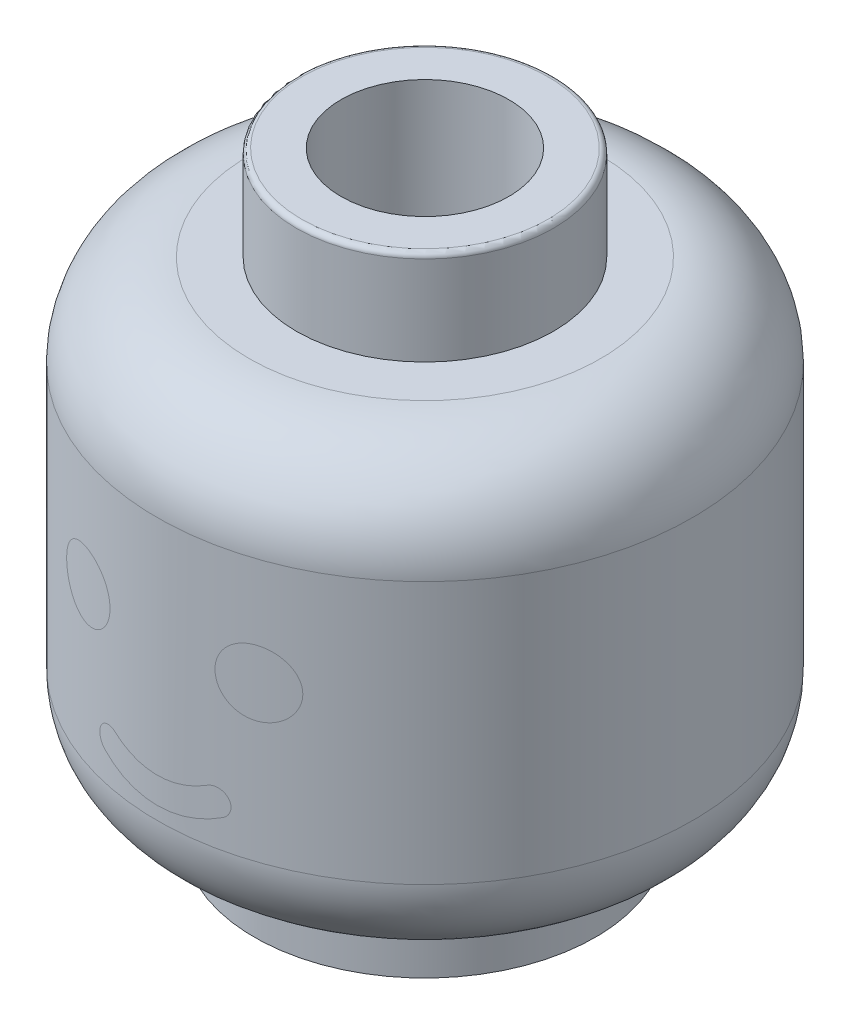
from build123d import *

# Parameters (mm, degrees)
SKETCH4_R          = 1.6
CUT_EXTRUDE1_DEPTH = 2
CUT_EXTRUDE2_REACH = 15.49
CIRPATTERN1_COUNT  = 3
FILLET1_R          = 0.1


with BuildPart() as part:
    # Sketch2 → Revolve1 (revolve)
    with BuildSketch(Plane(origin=(0, 0, 0), x_dir=(0, 0, -1), z_dir=(1, 0, 0))):
        with BuildLine():
            Line((2.45, 0), (3.25, 0))
            Line((3.25, 0), (3.25, 1.1))
            Line((3.25, 1.1), (3.35, 1.1))
            ThreePointArc((3.35, 1.1), (4.587436867, 1.612563133), (5.1, 2.85))
            Line((5.1, 2.85), (5.1, 7.85))
            ThreePointArc((5.1, 7.85), (4.587436867, 9.087436867), (3.35, 9.6))
            Line((3.35, 9.6), (2.45, 9.6))
            Line((2.45, 9.6), (2.45, 11.4))
            Line((2.45, 11.4), (0, 11.4))
            Line((0, 11.4), (0, 8.5))
            Line((0, 8.5), (2.45, 8.5))
            Line((2.45, 8.5), (2.45, 0))
        make_face()
    revolve(axis=Axis((0, 0, 0), (0, 1, 0)))

    # Sketch4 → Cut-Extrude1 (cut)
    with BuildSketch(Plane(origin=(0, 11.4, 0), x_dir=(1, 0, 0), z_dir=(0, 1, 0))):
        with Locations(Location((0, 0, 0), (0, 0, 270))):
            Circle(SKETCH4_R)
    extrude(amount=-CUT_EXTRUDE1_DEPTH, mode=Mode.SUBTRACT)

    # Sketch5 → Cut-Extrude2 (cut, up to next)
    with BuildSketch(Plane(origin=(0, 11.4, 0), x_dir=(1, 0, 0), z_dir=(0, 1, 0)), mode=Mode.PRIVATE) as cut_extrude2_sk1:
        with BuildLine():
            Line((-1.547048989, -0.408214924), (-0.42, 0.242487113))
            Line((-0.42, 0.242487113), (-0.42, 1.543891188))
            ThreePointArc((-0.42, 1.543891188), (-1.385640646, 0.8), (-1.547048989, -0.408214924))
        make_face()
    cut_extrude2_tool1 = extrude(cut_extrude2_sk1.sketch, amount=-CUT_EXTRUDE2_REACH, mode=Mode.PRIVATE) & part.part
    cut_extrude2 = cut_extrude2_tool1.solids().sort_by_distance((-0.969614, 11.4, -0.559807))[0]
    add(cut_extrude2, mode=Mode.SUBTRACT)

    # CirPattern1: Cut-Extrude2 ×3 about axis
    cirpattern1_axis = Axis((0, 0, 0), (0, 1, 0))
    for i in range(1, CIRPATTERN1_COUNT):
        add(cut_extrude2.rotate(cirpattern1_axis, i * 360 / CIRPATTERN1_COUNT), mode=Mode.SUBTRACT)

    # Fillet1
    fillet1_edges = [part.edges().sort_by_distance(p)[0] for p in [
        (0, 11.4, 2.45),
    ]]
    fillet(fillet1_edges, radius=FILLET1_R)


solid = part.part
